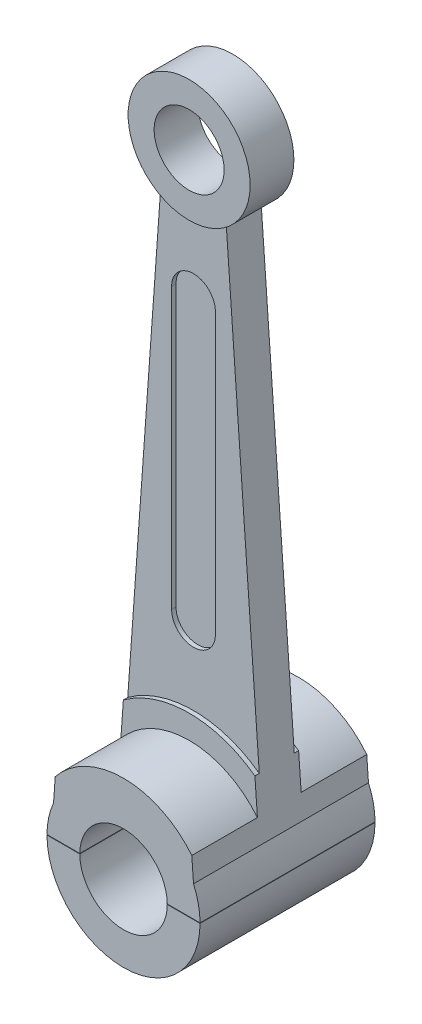
from build123d import *

# Parameters (mm, degrees)
SKETCH2_R                = 1.395
SKETCH2_R_2              = 0.8
BOSS_EXTRUDE1_DEPTH      = 0.5
SKETCH2_R_3              = 2.54
SKETCH2_R_4              = 1
BOSS_EXTRUDE1_2_DEPTH    = 0.5
BOSS_EXTRUDE2_DEPTH      = 0.4
BOSS_EXTRUDE3_DEPTH      = 0.3
BOSS_EXTRUDE4_DEPTH      = 1.5
BOSS_EXTRUDE4_DEPTH_BACK = 2.5
SKETCH3_R                = 2
SKETCH3_R_2              = 1
CUT_EXTRUDE1_DEPTH       = 15.75
SKETCH5_W                = 4.687829616
SKETCH5_H                = 0.01
CUT_EXTRUDE2_DEPTH       = 15.75


with BuildPart() as part:
    # Sketch2 → Boss-Extrude1 (new, symmetric)
    with BuildSketch(Plane.XY):
        with Locations((-2.238959124, 7.546189547)):
            Circle(SKETCH2_R)
        with Locations((-2.238959124, 7.546189547)):
            Circle(SKETCH2_R_2, mode=Mode.SUBTRACT)
    extrude(amount=BOSS_EXTRUDE1_DEPTH, both=True)



with BuildPart() as body_2:
    # Sketch2 → Boss-Extrude1 2 (new, symmetric)
    with BuildSketch(Plane.XY):
        with Locations((-2.238959124, -6.143810453)):
            Circle(SKETCH2_R_3)
        with Locations((-2.238959124, -6.143810453)):
            Circle(SKETCH2_R_4, mode=Mode.SUBTRACT)
    extrude(amount=BOSS_EXTRUDE1_2_DEPTH, both=True)


with BuildPart() as part_1:
    add(part.part)

    add(body_2.part)  # Boss-Extrude2 merges body 2
    # Sketch2<4> → Boss-Extrude2 (add, symmetric)
    with BuildSketch(Plane.XY):
        with BuildLine():
            Line((-2.988959124, 6.369956152), (-3.888959124, -4.212722677))
            ThreePointArc((-3.888959124, -4.212722677), (-2.238959124, -3.603810453), (-0.588959124, -4.212722677))
            Line((-0.588959124, -4.212722677), (-1.488959124, 6.369956152))
            ThreePointArc((-1.488959124, 6.369956152), (-2.238959124, 6.151189547), (-2.988959124, 6.369956152))
        make_face()
        with BuildLine():
            ThreePointArc((-2.738959124, 4.546189547), (-2.238959124, 5.046189547), (-1.738959124, 4.546189547))
            Line((-1.738959124, 4.546189547), (-1.738959124, -1.852472132))
            ThreePointArc((-1.738959124, -1.852472132), (-2.238959124, -2.352472132), (-2.738959124, -1.852472132))
            Line((-2.738959124, -1.852472132), (-2.738959124, 4.546189547))
        make_face(mode=Mode.SUBTRACT)
    extrude(amount=BOSS_EXTRUDE2_DEPTH, both=True)

    # Sketch2<5> → Boss-Extrude3 (add, symmetric)
    with BuildSketch(Plane.XY):
        with BuildLine():
            ThreePointArc((-1.738959124, 4.546189547), (-2.238959124, 5.046189547), (-2.738959124, 4.546189547))
            Line((-2.738959124, 4.546189547), (-2.738959124, -1.852472132))
            ThreePointArc((-2.738959124, -1.852472132), (-2.238959124, -2.352472132), (-1.738959124, -1.852472132))
            Line((-1.738959124, -1.852472132), (-1.738959124, 4.546189547))
        make_face()
    extrude(amount=BOSS_EXTRUDE3_DEPTH, both=True)

    # Sketch3 → Boss-Extrude4 (add, two sides: drawn at the far end of the back side and taken through both)
    with BuildSketch(Plane.XY.offset(0.5).offset(-BOSS_EXTRUDE4_DEPTH_BACK)):
        with Locations((-2.238959124, -6.143810453)):
            Circle(SKETCH3_R)
        with Locations((-2.238959124, -6.143810453)):
            Circle(SKETCH3_R_2, mode=Mode.SUBTRACT)
    extrude(amount=BOSS_EXTRUDE4_DEPTH + BOSS_EXTRUDE4_DEPTH_BACK)

    # Sketch4 → Cut-Extrude1 (cut, symmetric)
    with BuildSketch(Plane.XY.offset(2)):
        with BuildLine():
            Line((-5.204168886, -4.2843667), (-2.988959124, 6.369956152))
            Line((-2.988959124, 6.369956152), (-3.838959124, -5.434938109))
            ThreePointArc((-3.838959124, -5.434938109), (-2.238959124, -7.893810453), (-0.638959124, -5.434938109))
            Line((-0.638959124, -5.434938109), (-1.488959124, 6.369956152))
            Line((-1.488959124, 6.369956152), (0.726250638, -4.2843667))
            ThreePointArc((0.726250638, -4.2843667), (-2.238959124, -9.643810453), (-5.204168886, -4.2843667))
        make_face()
    extrude(amount=CUT_EXTRUDE1_DEPTH, both=True, mode=Mode.SUBTRACT)

    # Sketch5 → Cut-Extrude2 (cut, symmetric)
    with BuildSketch(Plane.XY.offset(2)):
        with Locations((-2.712865397, -6.138810453)):
            Rectangle(SKETCH5_W, SKETCH5_H)
    extrude(amount=CUT_EXTRUDE2_DEPTH, both=True, mode=Mode.SUBTRACT)


with BuildPart() as cut_extrude2_piece_1:
    # of the separate pieces the step leaves, piece 1, a body of its own (cut_extrude2_pieces)
    add(part_1.part.solids().sort_by_distance((-0.735317687, -4.096699702, -0.5))[0])


with BuildPart() as cut_extrude2_piece_2:
    # of the separate pieces the step leaves, piece 2, a body of its own (cut_extrude2_pieces)
    add(part_1.part.solids().sort_by_distance((-3.988959124, -6.143810453, 2))[0])


solid = Compound([cut_extrude2_piece_1.part, cut_extrude2_piece_2.part])
